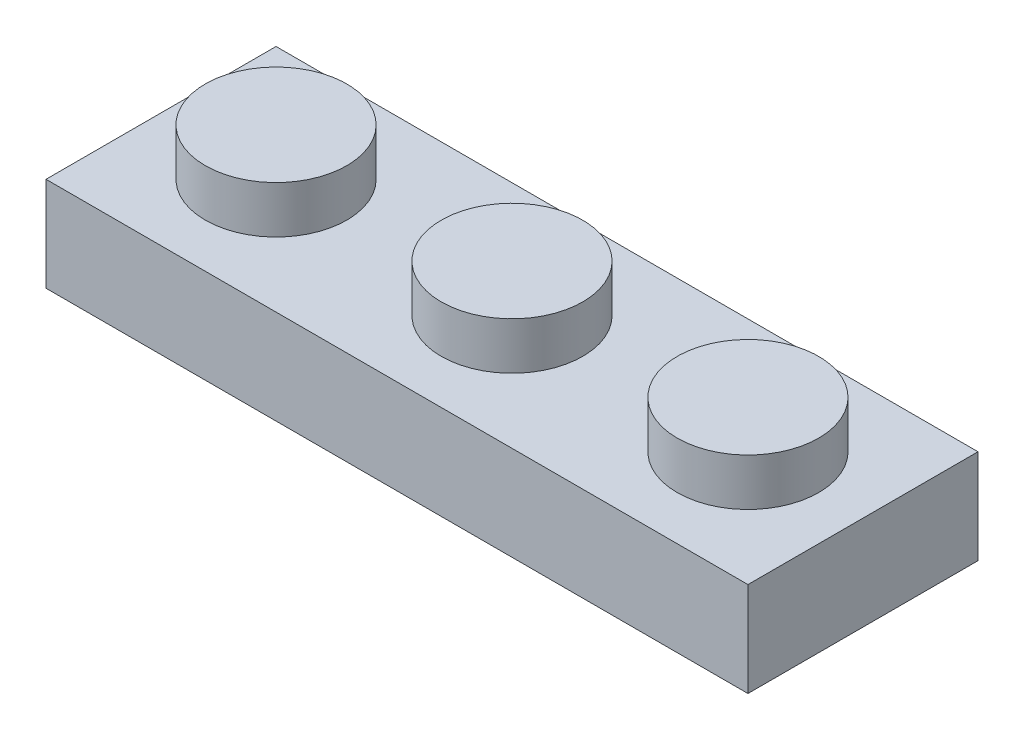
from build123d import *

# Parameters (mm, degrees)
SKETCH1_W            = 23.8
SKETCH1_H            = 3.2
BOSS_EXTRUDE1_DEPTH  = 7.8
SKETCH2_R            = 2.4
BOSS_EXTRUDE2_DEPTH  = 1.6
LPATTERN1_COUNT      = 2
LPATTERN1_PITCH      = 8
LPATTERN1_COUNT_DIR2 = 4
LPATTERN1_PITCH_DIR2 = 8
SHELL1_T             = -1.2
SKETCH3_R            = 1.5
SKETCH3_R_2          = 0.6
BOSS_EXTRUDE3_DEPTH  = 1.8
LPATTERN2_COUNT      = 2
LPATTERN2_PITCH      = 8


with BuildPart() as part:
    # Sketch1 → Boss-Extrude1 (new body)
    with BuildSketch(Plane.XY):
        with Locations((11.9, 1.6)):
            Rectangle(SKETCH1_W, SKETCH1_H)
    extrude(amount=-BOSS_EXTRUDE1_DEPTH)

    # Sketch2 → Boss-Extrude2 (add)
    with BuildSketch(Plane(origin=(0, 3.2, 0), x_dir=(1, 0, 0), z_dir=(0, 1, 0))):
        with Locations(Location((3.9, 3.9, 0), (0, 0, 270))):
            Circle(SKETCH2_R)
    boss_extrude2 = extrude(amount=BOSS_EXTRUDE2_DEPTH)

    # LPattern1: Boss-Extrude2 2 × 4, 5 skipped
    with Locations(*[(j * LPATTERN1_PITCH_DIR2, 0, i * LPATTERN1_PITCH) for i in range(LPATTERN1_COUNT) for j in range(LPATTERN1_COUNT_DIR2) if (i, j) not in ((0, 0), (0, 3), (1, 0), (1, 1), (1, 2), (1, 3))]):
        add(boss_extrude2)

    # Shell1
    shell1_openings = [part.faces().sort_by_distance(p)[0] for p in [
        (11.9, 0, -3.9),
    ]]
    offset(amount=SHELL1_T, openings=shell1_openings, kind=Kind.INTERSECTION)

    # Sketch3 → Boss-Extrude3 (add)
    with BuildSketch(Plane.XZ.offset(-2)):
        with Locations(Location((7.9, -3.9, 0), (0, 0, 90))):
            Circle(SKETCH3_R)
        with Locations(Location((7.9, -3.9, 0), (0, 0, 270))):
            Circle(SKETCH3_R_2, mode=Mode.SUBTRACT)
    boss_extrude3 = extrude(amount=BOSS_EXTRUDE3_DEPTH)

    # LPattern2: Boss-Extrude3 ×2
    with Locations(*[(i * LPATTERN2_PITCH, 0, 0) for i in range(1, LPATTERN2_COUNT)]):
        add(boss_extrude3)


solid = part.part
